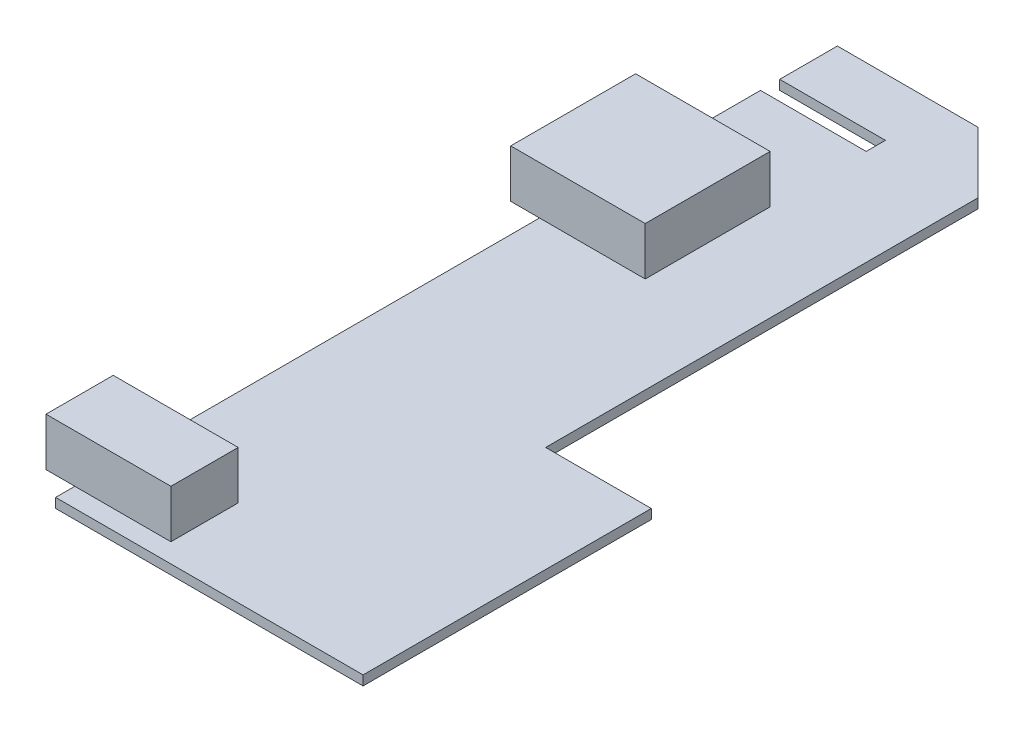
from build123d import *

# Parameters (mm, degrees)
EXTRUDE_1_DEPTH = 1
SKETCH_2_W      = 13
SKETCH_2_H      = 7
EXTRUDE_2_DEPTH = 5
SKETCH_3_W      = 14
SKETCH_3_H      = 13
EXTRUDE_3_DEPTH = 5


with BuildPart() as part:
    # 草圖1 → 填料-伸長1 (new body)
    with BuildSketch(Plane(origin=(0, 0, 0), x_dir=(1, 0, 0), z_dir=(0, 1, 0))):
        Polygon((0, 0), (32, 0), (32, 30), (21, 30), (21, 75), (14.636038969, 81.363961031), (0, 81.363961031), (0, 75.363961031), (11, 75.363961031), (11, 73.363961031), (0, 73.363961031), align=None)
    extrude(amount=EXTRUDE_1_DEPTH)

    # 草圖2 → 填料-伸長2 (add)
    with BuildSketch(Plane(origin=(0, 1, 0), x_dir=(1, 0, 0), z_dir=(0, 1, 0))):
        with Locations((3.5, 5.5)):
            Rectangle(SKETCH_2_W, SKETCH_2_H)
    extrude(amount=EXTRUDE_2_DEPTH)

    # 草圖3 → 填料-伸長3 (add)
    with BuildSketch(Plane(origin=(0, 1, 0), x_dir=(1, 0, 0), z_dir=(0, 1, 0))):
        with Locations((4, 56.863961031)):
            Rectangle(SKETCH_3_W, SKETCH_3_H)
    extrude(amount=EXTRUDE_3_DEPTH)


solid = part.part
